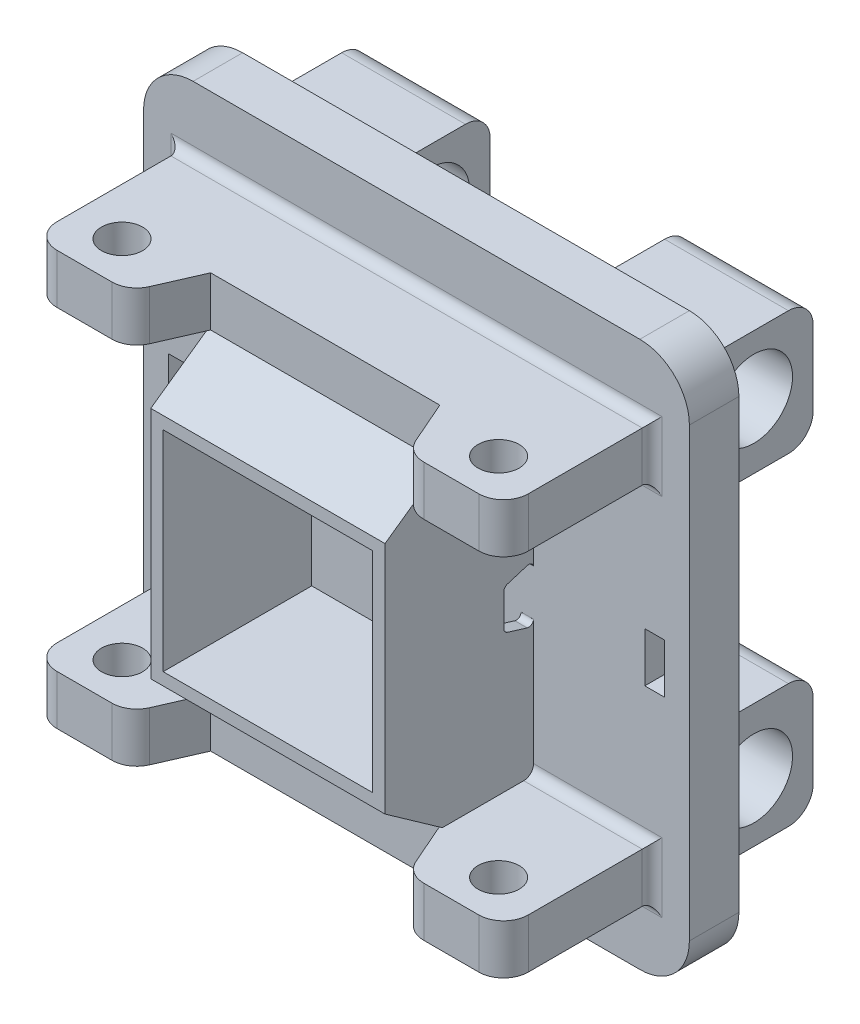
from build123d import *

# Parameters (mm, degrees)
SCHIZZO1_W                   = 110.21
SCHIZZO1_H                   = 110.21
ESTRUSIONE_ESTRUSIONE1_DEPTH = 10
RACCORDO1_R                  = 10
SCHIZZO6_W                   = 25
SCHIZZO6_H                   = 25
ESTRUSIONE_ESTRUSIONE2_DEPTH = 25
RACCORDO2_R                  = 5
SCHIZZO8_W                   = 47.3
SCHIZZO8_H                   = 47.3
SCHIZZO8_W_2                 = 42.3
SCHIZZO8_H_2                 = 42.3
ESTRUSIONE_ESTRUSIONE4_DEPTH = 30
SCHIZZO16_W                  = 4
SCHIZZO16_H                  = 10
TAGLIO_ESTRUSIONE11_DEPTH    = 10
SCHIZZO20_R                  = 7.8
TAGLIO_ESTRUSIONE12_DEPTH    = 25
RACCORDO11_R                 = 5
RACCORDO12_R                 = 5
RACCORDO13_R                 = 5
SCHIZZO10_W                  = 95.163374128
SCHIZZO10_H                  = 10
ESTRUSIONE_ESTRUSIONE5_DEPTH = 30
SCHIZZO21_R                  = 4.15
TAGLIO_ESTRUSIONE13_DEPTH    = 17
RACCORDO15_R                 = 5
RACCORDO16_R                 = 2
RACCORDO15_OF_SPECCHIA20_R   = 5
RACCORDO16_OF_SPECCHIA20_R   = 2
ESTRUSIONE_ESTRUSIONE7_REACH = 106.11
TAGLIO_ESTRUSIONE16_DEPTH    = 8.05
RACCORDO18_R                 = 1
TAGLIO_ESTRUSIONE14_DEPTH    = 17


with BuildPart() as part:
    # Schizzo1 → Estrusione-Estrusione1 (new body)
    with BuildSketch(Plane.XY):
        Rectangle(SCHIZZO1_W, SCHIZZO1_H)
    extrude(amount=ESTRUSIONE_ESTRUSIONE1_DEPTH)

    # Raccordo1
    raccordo1_edges = [part.edges().sort_by_distance(p)[0] for p in [
        (55.105, -55.105, 5),
        (-55.105, -55.105, 5),
        (-55.105, 55.105, 5),
        (55.105, 55.105, 5),
    ]]
    fillet(raccordo1_edges, radius=RACCORDO1_R)

    # Schizzo6 → Estrusione-Estrusione2 (add)
    with BuildSketch(Plane(origin=(0, 0, 0), x_dir=(-1, 0, 0), z_dir=(0, 0, -1))):
        with Locations((-32.605, 32.605)):
            Rectangle(SCHIZZO6_W, SCHIZZO6_H)
        with Locations((-32.605, -32.605)):
            Rectangle(SCHIZZO6_W, SCHIZZO6_H)
    estrusione_estrusione2 = extrude(amount=ESTRUSIONE_ESTRUSIONE2_DEPTH)

    # Raccordo2
    raccordo2_edges = [part.edges().sort_by_distance(p)[0] for p in [
        (32.605, 20.105, -25),
        (32.605, 45.105, -25),
    ]]
    fillet(raccordo2_edges, radius=RACCORDO2_R)

    # Schizzo8 → Estrusione-Estrusione4 (add)
    with BuildSketch(Plane.XY.offset(10)):
        Rectangle(SCHIZZO8_W, SCHIZZO8_H)
        Rectangle(SCHIZZO8_W_2, SCHIZZO8_H_2, mode=Mode.SUBTRACT)
    extrude(amount=ESTRUSIONE_ESTRUSIONE4_DEPTH)

    # Schizzo16 → Taglio-Estrusione11 (cut)
    with BuildSketch(Plane(origin=(0, 0, 0), x_dir=(-1, 0, 0), z_dir=(0, 0, -1))):
        with Locations((-48.105, 0)):
            Rectangle(SCHIZZO16_W, SCHIZZO16_H)
        with Locations((48.105, 0)):
            Rectangle(SCHIZZO16_W, SCHIZZO16_H)
    extrude(amount=-TAGLIO_ESTRUSIONE11_DEPTH, mode=Mode.SUBTRACT)

    # Schizzo20 → Taglio-Estrusione12 (cut)
    with BuildSketch(Plane(origin=(45.105, 0, 0), x_dir=(0, 0, -1), z_dir=(1, 0, 0))):
        with Locations((13.030698379, 33.188614524)):
            Circle(SCHIZZO20_R)
        with Locations(Location((13.030698379, -33.188614524, 0), (0, 0, 180))):
            Circle(SCHIZZO20_R)
    taglio_estrusione12 = extrude(amount=-TAGLIO_ESTRUSIONE12_DEPTH, mode=Mode.SUBTRACT)

    # Raccordo11
    raccordo11_edges = [part.edges().sort_by_distance(p)[0] for p in [
        (32.605, -20.105, -25),
    ]]
    fillet(raccordo11_edges, radius=RACCORDO11_R)

    # Raccordo12
    raccordo12_edges = [part.edges().sort_by_distance(p)[0] for p in [
        (32.605, -45.105, -25),
    ]]
    fillet(raccordo12_edges, radius=RACCORDO12_R)

    # Specchia17: Estrusione-Estrusione2 across plane
    add(estrusione_estrusione2.mirror(Plane(origin=(0, 0, 0), x_dir=(0, 0, 1), z_dir=(1, 0, 0))))

    # Specchia19: Taglio-Estrusione12 across plane
    add(taglio_estrusione12.mirror(Plane(origin=(0, 0, 0), x_dir=(0, 0, 1), z_dir=(1, 0, 0))), mode=Mode.SUBTRACT)

    # Raccordo13
    raccordo13_edges = [part.edges().sort_by_distance(p)[0] for p in [
        (-32.605, 45.105, -25),
        (-32.605, 20.105, -25),
        (-32.605, -45.105, -25),
        (-32.605, -20.105, -25),
    ]]
    fillet(raccordo13_edges, radius=RACCORDO13_R)

    # Schizzo10 → Estrusione-Estrusione5 (add)
    with BuildSketch(Plane.XY.offset(10)):
        with Locations((0, -36.820977582)):
            Rectangle(SCHIZZO10_W, SCHIZZO10_H)
    estrusione_estrusione5 = extrude(amount=ESTRUSIONE_ESTRUSIONE5_DEPTH)

    # Schizzo21 → Taglio-Estrusione13 (cut)
    with BuildSketch(Plane.XZ.offset(41.820977582)):
        with Locations(Location((-38.020045692, 31.433841087, 0), (0, 0, 270))):
            Circle(SCHIZZO21_R)
        with Locations(Location((38.020045692, 31.433841087, 0), (0, 0, 90))):
            Circle(SCHIZZO21_R)
        Polygon((-28.203808042, 40), (-23.137362803, 28.426939363), (23.137362803, 28.426939363), (28.203808042, 40), align=None)
    taglio_estrusione13 = extrude(amount=-TAGLIO_ESTRUSIONE13_DEPTH, mode=Mode.SUBTRACT)

    # Raccordo15
    raccordo15_edges = [part.edges().sort_by_distance(p)[0] for p in [
        (47.581687064, -36.820977582, 40),
        (-47.581687064, -36.820977582, 40),
        (-28.203808042, -36.820977582, 40),
        (28.203808042, -36.820977582, 40),
    ]]
    fillet(raccordo15_edges, radius=RACCORDO15_R)

    # Raccordo16
    raccordo16_edges = [part.edges().sort_by_distance(p)[0] for p in [
        (-47.581687064, -36.820977582, 10),
        (0, -41.820977582, 10),
        (0, -31.820977582, 10),
        (47.581687064, -36.820977582, 10),
    ]]
    fillet(raccordo16_edges, radius=RACCORDO16_R)

    # Specchia20: Estrusione-Estrusione5, Taglio-Estrusione13 across plane
    add(estrusione_estrusione5.mirror(Plane.ZX))
    add(taglio_estrusione13.mirror(Plane.ZX), mode=Mode.SUBTRACT)

    # Raccordo15 of Specchia20
    raccordo15_of_specchia20_edges = [part.edges().sort_by_distance(p)[0] for p in [
        (47.581687064, 36.820977582, 40),
        (-47.581687064, 36.820977582, 40),
        (-28.203808042, 36.820977582, 40),
        (28.203808042, 36.820977582, 40),
    ]]
    fillet(raccordo15_of_specchia20_edges, radius=RACCORDO15_OF_SPECCHIA20_R)

    # Raccordo16 of Specchia20
    raccordo16_of_specchia20_edges = [part.edges().sort_by_distance(p)[0] for p in [
        (-47.581687064, 36.820977582, 10),
        (0, 41.820977582, 10),
        (0, 31.820977582, 10),
        (47.581687064, 36.820977582, 10),
    ]]
    fillet(raccordo16_of_specchia20_edges, radius=RACCORDO16_OF_SPECCHIA20_R)

    # Estrusione-Estrusione7: up to this face of the body (flat: up to its plane)
    estrusione_estrusione7_end = Plane(part.part.faces().sort_by_distance((23.65, 0, 25))[0])
    # Schizzo29 → Estrusione-Estrusione7 (add, up to the picked face)
    with BuildSketch(Plane.ZY.offset(23.65), mode=Mode.PRIVATE) as estrusione_estrusione7_sk1:
        Polygon((40, 23.65), (28.426939363, 31.820977582), (10, 31.820977582), (10, 23.65), align=None)
    estrusione_estrusione7_tool1 = split(extrude(estrusione_estrusione7_sk1.sketch, amount=-ESTRUSIONE_ESTRUSIONE7_REACH, mode=Mode.PRIVATE), bisect_by=estrusione_estrusione7_end, keep=Keep.BOTH, mode=Mode.PRIVATE)
    estrusione_estrusione7 = estrusione_estrusione7_tool1.solids().sort_by(Axis((-23.65, 27.410039, 22.337212), (1, 0, 0)))[0]
    add(estrusione_estrusione7)

    # Specchia22: Estrusione-Estrusione7 across plane
    add(estrusione_estrusione7.mirror(Plane.ZX))

    # Schizzo30 → Taglio-Estrusione16 (cut)
    with BuildSketch(Plane(origin=(23.65, 0, 0), x_dir=(0, 0, -1), z_dir=(1, 0, 0))):
        Polygon((-16, -4), (-10, -5.843863655), (-10, -4), (-10, 4), (-10, 5.843863655), (-16, 4), align=None)
    extrude(amount=-TAGLIO_ESTRUSIONE16_DEPTH, mode=Mode.SUBTRACT)

    # Raccordo18
    raccordo18_edges = [part.edges().sort_by_distance(p)[0] for p in [
        (22.4, -5.843863655, 10),
        (22.4, -4, 16),
        (22.4, 4, 16),
        (22.4, 5.843863655, 10),
    ]]
    fillet(raccordo18_edges, radius=RACCORDO18_R)

    # Schizzo28 → Taglio-Estrusione14 (cut)
    with BuildSketch(Plane.ZY.offset(-21.15)):
        with BuildLine():
            Line((10, 4.773633228), (10, -4.589423386))
            ThreePointArc((10, -4.589423386), (14.681528307, 0.092104921), (10, 4.773633228))
        make_face()
    extrude(amount=-TAGLIO_ESTRUSIONE14_DEPTH, mode=Mode.SUBTRACT)


solid = part.part
